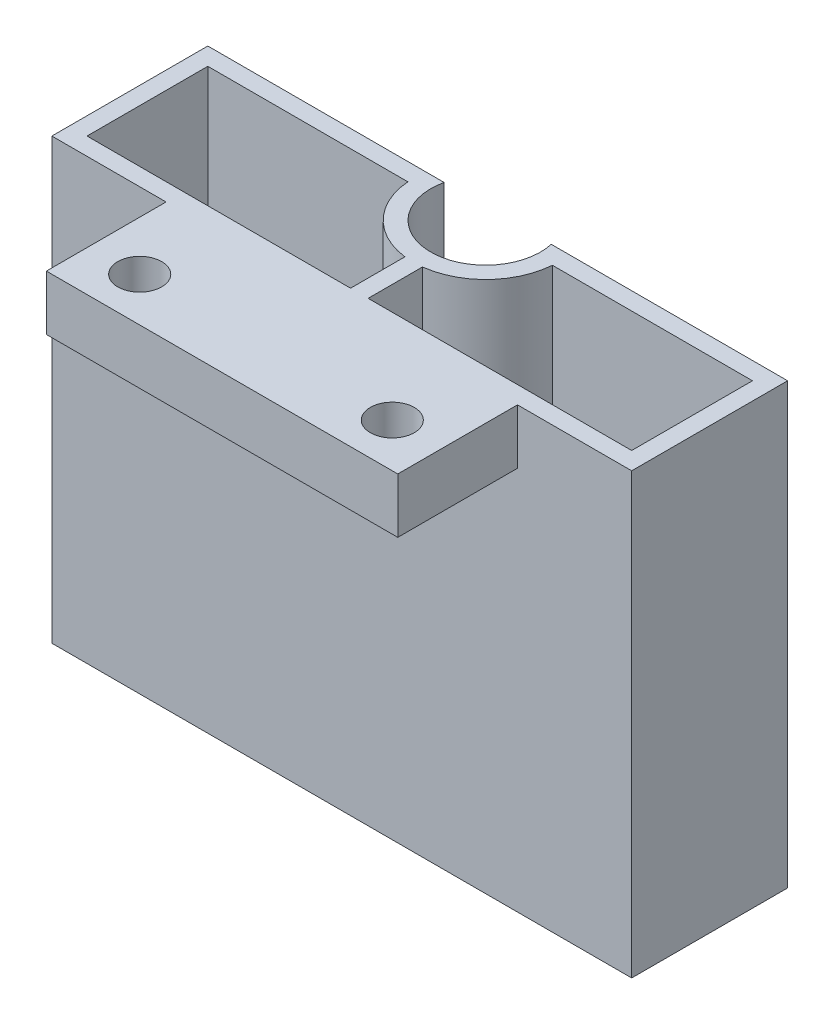
from build123d import *

# Parameters (mm, degrees)
ESBO_O2_W                = 16
ESBO_O2_H                = 6
ESBO_O2_R                = 1
RESSALTO_EXTRUS_O4_DEPTH = 2.5
RESSALTO_EXTRUS_O6_DEPTH = 20


with BuildPart() as part:
    # Esboço2 → Ressalto-extrusão4 (new body)
    with BuildSketch(Plane(origin=(0, 0, 0), x_dir=(1, 0, 0), z_dir=(0, 1, 0))):
        Rectangle(ESBO_O2_W, ESBO_O2_H)
        with Locations(Location((-5.75, -1, 0), (0, 0, 270))):
            Circle(ESBO_O2_R, mode=Mode.SUBTRACT)
        with Locations(Location((5.75, -1, 0), (0, 0, 270))):
            Circle(ESBO_O2_R, mode=Mode.SUBTRACT)
    extrude(amount=RESSALTO_EXTRUS_O4_DEPTH)

    # Esboço4 → Ressalto-extrusão6 (add)
    with BuildSketch(Plane(origin=(0, 2.5, 0), x_dir=(1, 0, 0), z_dir=(0, 1, 0))):
        with BuildLine():
            Line((13.2, 2.45), (-13.2, 2.45))
            Line((-13.2, 2.45), (-13.2, 9.55))
            Line((-13.2, 9.55), (-2.43874968, 9.55))
            ThreePointArc((-2.43874968, 9.55), (0, 6.5), (2.43874968, 9.55))
            Line((2.43874968, 9.55), (13.2, 9.55))
            Line((13.2, 9.55), (13.2, 2.45))
        make_face()
        with BuildLine():
            Line((3.290516677, 8.75), (12.4, 8.75))
            Line((12.4, 8.75), (12.4, 3.25))
            Line((12.4, 3.25), (0.4, 3.25))
            Line((0.4, 3.25), (0.4, 5.724332129))
            ThreePointArc((0.4, 5.724332129), (2.386135967, 6.720448476), (3.290516677, 8.75))
        make_face(mode=Mode.SUBTRACT)
        with BuildLine():
            Line((-0.4, 3.25), (-12.4, 3.25))
            Line((-12.4, 3.25), (-12.4, 8.75))
            Line((-12.4, 8.75), (-3.290516677, 8.75))
            ThreePointArc((-3.290516677, 8.75), (-2.386135967, 6.720448476), (-0.4, 5.724332129))
            Line((-0.4, 5.724332129), (-0.4, 3.25))
        make_face(mode=Mode.SUBTRACT)
    extrude(amount=-RESSALTO_EXTRUS_O6_DEPTH)


solid = part.part
